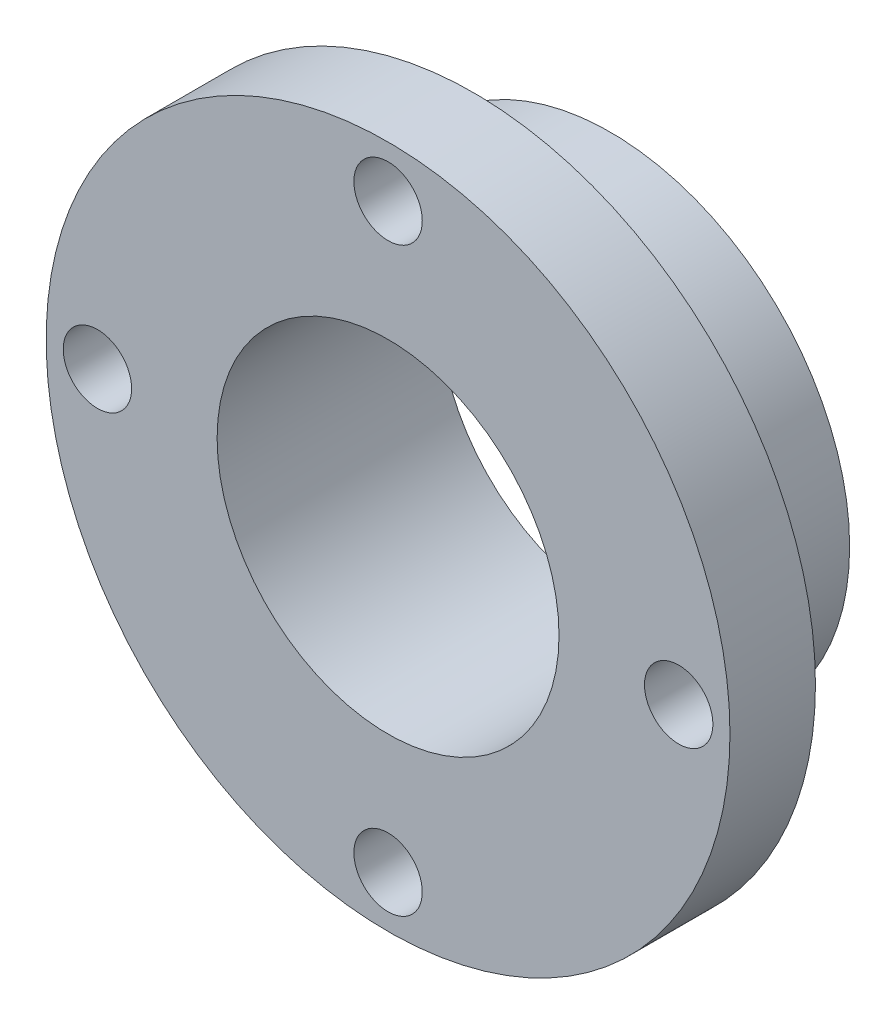
from build123d import *
from build123d.topology import SkipClean

# Parameters (mm, degrees)
SKETCH1_R           = 20
SKETCH1_R_2         = 10
BOSS_EXTRUDE1_DEPTH = 5
BOSS_EXTRUDE2_START = 8
SKETCH2_R           = 14
SKETCH2_R_2         = 10
BOSS_EXTRUDE2_DEPTH = 8
FILLET1_R           = 1
SKETCH3_R           = 2
CUT_EXTRUDE1_DEPTH  = 10
CIRPATTERN1_COUNT   = 4


with BuildPart() as part:
    # Sketch1 → Boss-Extrude1 (new body)
    with BuildSketch(Plane.XY):
        Circle(SKETCH1_R)
        Circle(SKETCH1_R_2, mode=Mode.SUBTRACT)
    extrude(amount=BOSS_EXTRUDE1_DEPTH)

    # Sketch2 → Boss-Extrude2 (add)
    with SkipClean():  # the faces are left unmerged after this step: merging them gives an invalid solid
        with BuildSketch(Plane(origin=(0, 0, 0), x_dir=(-1, 0, 0), z_dir=(0, 0, -1)).offset(BOSS_EXTRUDE2_START)):
            with Locations(Location((0, 0, 0), (0, 0, 180))):
                Circle(SKETCH2_R)
            Circle(SKETCH2_R_2, mode=Mode.SUBTRACT)
        extrude(amount=-BOSS_EXTRUDE2_DEPTH)

    # Fillet1
    fillet1_edges = [part.edges().sort_by_distance(p)[0] for p in [
        (-14, 0, 0),
    ]]
    fillet(fillet1_edges, radius=FILLET1_R)

    # Sketch3 → Cut-Extrude1 (cut)
    with SkipClean():  # the faces are left unmerged after this step: merging them gives an invalid solid
        with BuildSketch(Plane(origin=(0, 0, 0), x_dir=(-1, 0, 0), z_dir=(0, 0, -1))):
            with Locations(Location((0, 17, 0), (0, 0, 270))):
                Circle(SKETCH3_R)
        cut_extrude1 = extrude(amount=-CUT_EXTRUDE1_DEPTH, mode=Mode.SUBTRACT)

    # CirPattern1: Cut-Extrude1 ×4 about axis
    with SkipClean():  # the faces are left unmerged after this step: merging them gives an invalid solid
        cirpattern1_axis = Axis((0, 0, 0), (0, 0, 1))
        for i in range(1, CIRPATTERN1_COUNT):
            add(cut_extrude1.rotate(cirpattern1_axis, i * 360 / CIRPATTERN1_COUNT), mode=Mode.SUBTRACT)


solid = part.part
